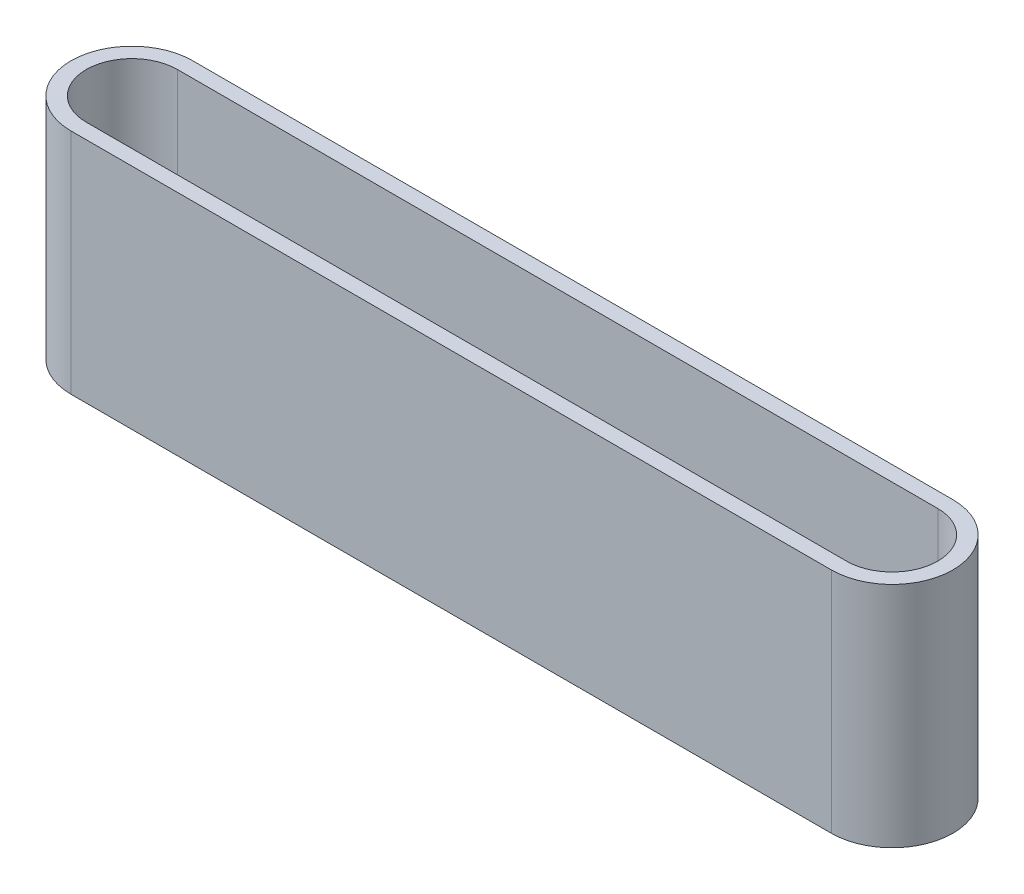
from build123d import *

# Parameters (mm, degrees)
BOSS_EXTRUDE1_DEPTH = 150


with BuildPart() as part:
    # Sketch1 → Boss-Extrude1 (new body)
    with BuildSketch(Plane(origin=(0, 0, 0), x_dir=(1, 0, 0), z_dir=(0, 1, 0))):
        with BuildLine():
            Line((0, -40), (-500, -40))
            ThreePointArc((-500, -40), (-540, 0), (-500, 40))
            Line((-500, 40), (0, 40))
            ThreePointArc((0, 40), (40, 0), (0, -40))
        make_face()
        with BuildLine():
            Line((0, -30), (-500, -30))
            ThreePointArc((-500, -30), (-530, 0), (-500, 30))
            Line((-500, 30), (0, 30))
            ThreePointArc((0, 30), (30, 0), (0, -30))
        make_face(mode=Mode.SUBTRACT)
    extrude(amount=BOSS_EXTRUDE1_DEPTH)


solid = part.part
